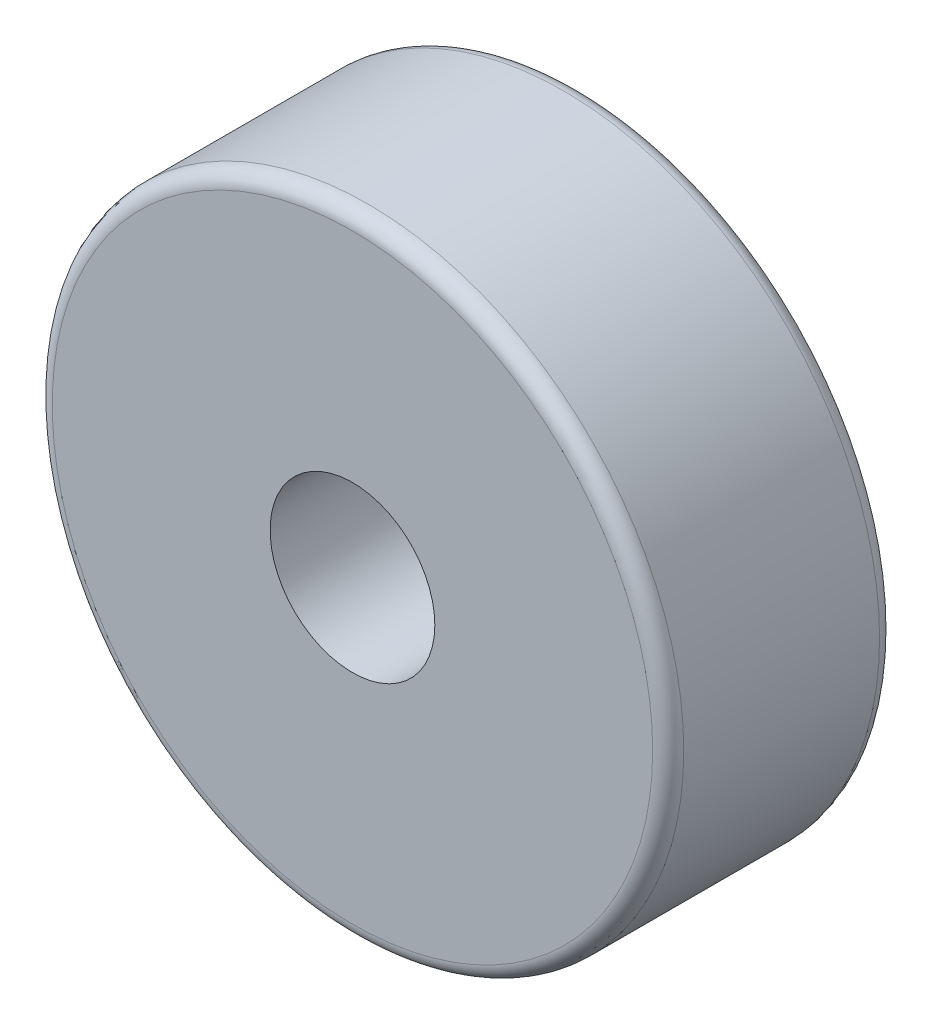
from build123d import *

# Parameters (mm, degrees)
ESQUISSE1_R        = 101.6
ESQUISSE1_R_2      = 26.5
BOSS_EXTRU_1_DEPTH = 73
CONG_1_R           = 5


with BuildPart() as part:
    # Esquisse1 → Boss.-Extru.1 (new body)
    with BuildSketch(Plane.XY):
        Circle(ESQUISSE1_R)
        Circle(ESQUISSE1_R_2, mode=Mode.SUBTRACT)
    extrude(amount=BOSS_EXTRU_1_DEPTH)

    # Congé1
    cong_1_edges = [part.edges().sort_by_distance(p)[0] for p in [
        (-101.6, 0, 0),
        (-101.6, 0, 73),
    ]]
    fillet(cong_1_edges, radius=CONG_1_R)


solid = part.part
